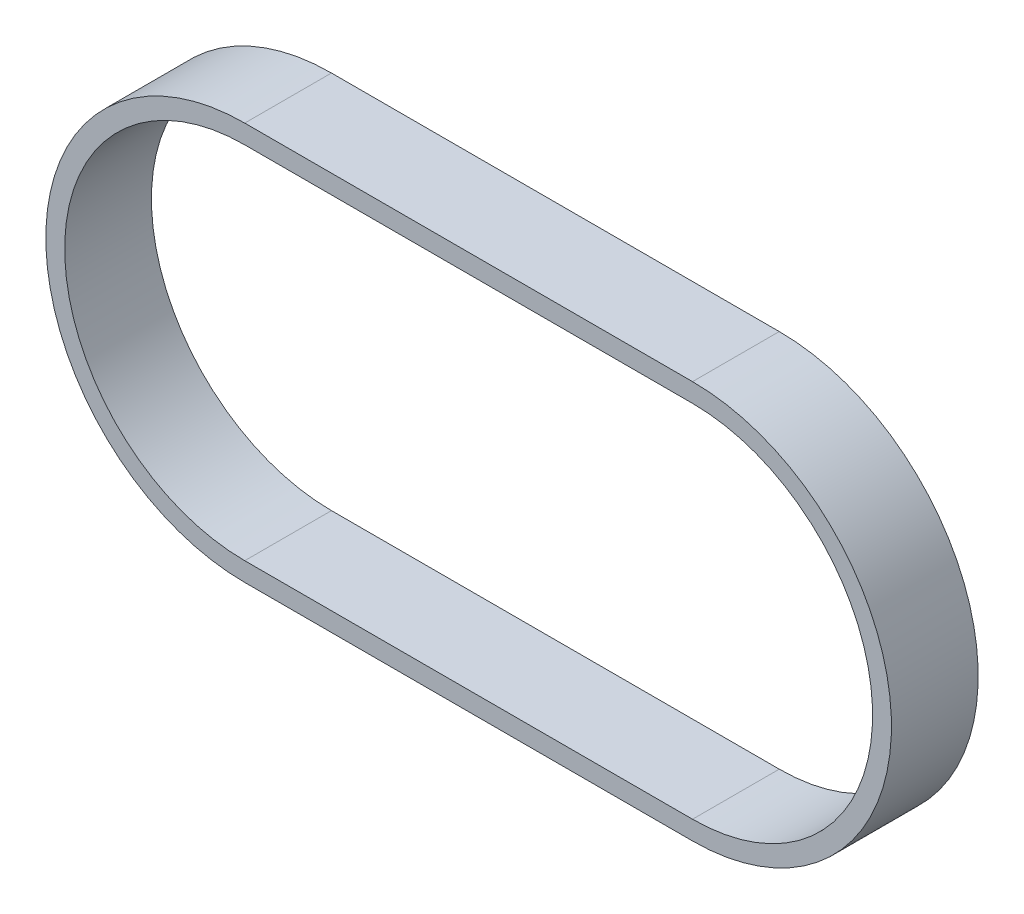
from build123d import *

# Parameters (mm, degrees)
EXTRUDE_THIN1_DEPTH = 9.2


with BuildPart() as part:
    # Sketch1 → Extrude-Thin1 (new body)
    with BuildSketch(Plane.XY):
        with BuildLine():
            Line((0, 21.1), (47.5, 21.1))
            ThreePointArc((47.5, 21.1), (68.6, 0), (47.5, -21.1))
            Line((47.5, -21.1), (0, -21.1))
            ThreePointArc((0, -21.1), (-21.1, 0), (0, 21.1))
        make_face()
        with BuildLine():
            Line((0, 19.1), (47.5, 19.1))
            ThreePointArc((47.5, 19.1), (66.6, 0), (47.5, -19.1))
            Line((47.5, -19.1), (0, -19.1))
            ThreePointArc((0, -19.1), (-19.1, 0), (0, 19.1))
        make_face(mode=Mode.SUBTRACT)
    extrude(amount=EXTRUDE_THIN1_DEPTH)


solid = part.part
